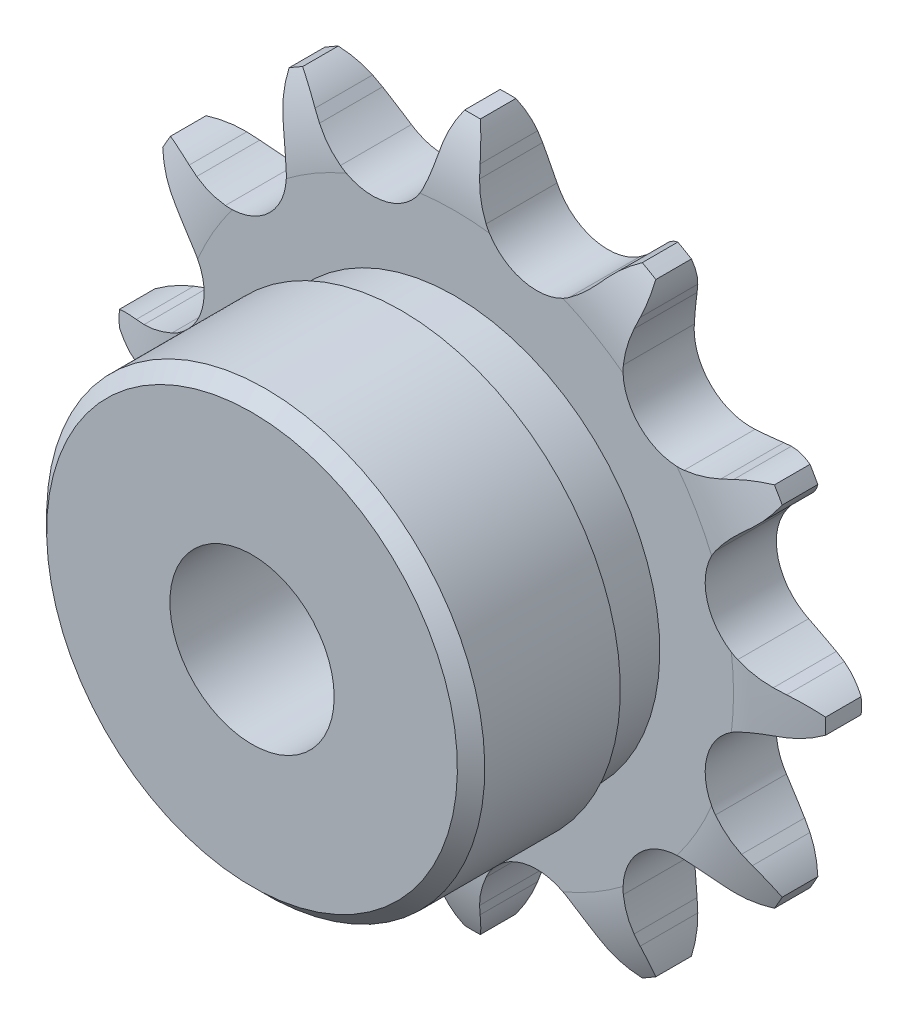
from build123d import *

# Parameters (mm, degrees)
CUT_EXTRUDE1_DEPTH      = 19.425253203
CIRPATTERN1_COUNT       = 12
BOSS_EXTRUDE1_START     = 1.3
SKETCH2_R               = 8
BOSS_EXTRUDE1_DEPTH     = 7.4
CUT_EXTRUDE2_DEPTH      = 21.334452557
CUT_EXTRUDE2_DEPTH_BACK = 21.334452557
SKETCH3_R               = 3
SKETCH4_W               = 1.95
SKETCH4_H               = 5.505042508
CUT_EXTRUDE3_DEPTH      = 21.334452557
CUT_EXTRUDE3_DEPTH_BACK = 21.334452557
SKETCH5_OUTSIDE_W       = 35.61
SKETCH5_OUTSIDE_H       = 35.61
SKETCH5_OUTSIDE_R       = 12.9


with BuildPart() as part:
    # Sketch1 → Revolve1 (revolve)
    with BuildSketch(Plane(origin=(0, 0, 0), x_dir=(0, 0, -1), z_dir=(1, 0, 0))):
        with BuildLine():
            Line((1.3, 0), (-1.3, 0))
            Line((-1.3, 0), (-1.3, 10.183680201))
            ThreePointArc((-1.3, 10.183680201), (-1.122370651, 11.632817875), (-0.6, 12.996152423))
            Line((-0.6, 12.996152423), (0.6, 12.996152423))
            ThreePointArc((0.6, 12.996152423), (1.122370651, 11.632817875), (1.3, 10.183680201))
            Line((1.3, 10.183680201), (1.3, 0))
        make_face()
    revolve(axis=Axis((0, 0, -1.3), (0, 0, 1)))

    # Sketch0 → Cut-Extrude1 (cut, symmetric)
    with BuildSketch(Plane.XY):
        with BuildLine():
            Line((5.347244826, -10.623186043), (5.08501768, -10.328523782))
            ThreePointArc((5.08501768, -10.328523782), (4.653470586, -9.896976688), (4.174741899, -9.518447121))
            ThreePointArc((4.174741899, -9.518447121), (2.469912714, -9.217839738), (1.143791021, -10.330587961))
            ThreePointArc((1.143791021, -10.330587961), (0.918464601, -10.897768526), (0.760507401, -11.487272819))
            Line((0.760507401, -11.487272819), (0.680743162, -11.873571395))
            ThreePointArc((0.680743162, -11.873571395), (-0.793674712, -14.017386392), (-3.35777046, -14.459273028))
            ThreePointArc((-3.35777046, -14.459273028), (3.841917429, -14.338231043), (10.137551033, -10.843212533))
            ThreePointArc((10.137551033, -10.843212533), (7.696035659, -11.742575354), (5.347244826, -10.623186043))
        make_face()
    cut_extrude1 = extrude(amount=CUT_EXTRUDE1_DEPTH, both=True, mode=Mode.SUBTRACT)

    # CirPattern1: Cut-Extrude1 ×12 about axis
    cirpattern1_axis = Axis((0, 0, 0), (0, 0, 1))
    for i in range(1, CIRPATTERN1_COUNT):
        add(cut_extrude1.rotate(cirpattern1_axis, i * 360 / CIRPATTERN1_COUNT), mode=Mode.SUBTRACT)

    # Sketch2 → Boss-Extrude1 (add)
    with BuildSketch(Plane.XY.offset(BOSS_EXTRUDE1_START)):
        with Locations(Location((0, 0, 0), (0, 0, 270))):
            Circle(SKETCH2_R)
    extrude(amount=BOSS_EXTRUDE1_DEPTH)

    # Sketch3 → Cut-Extrude2 (cut, two sides: drawn at the far end of the back side and taken through both)
    with BuildSketch(Plane.XY.offset(-CUT_EXTRUDE2_DEPTH_BACK)):
        Circle(SKETCH3_R)
    extrude(amount=CUT_EXTRUDE2_DEPTH + CUT_EXTRUDE2_DEPTH_BACK, mode=Mode.SUBTRACT)

    # Sketch4 → Cut-Revolve1 (revolve, cut)
    with BuildSketch(Plane(origin=(0, 0, 0), x_dir=(0, 0, -1), z_dir=(1, 0, 0))):
        Polygon((-8.7, 8), (-8.7, 7.5), (-8.2, 8), align=None)
        with Locations((-2.275, 10.243631169)):
            Rectangle(SKETCH4_W, SKETCH4_H)
    revolve(axis=Axis((0, 0, -1.3), (0, 0, 1)), mode=Mode.SUBTRACT)

    # Sketch5 outside → Cut-Extrude3 (cut, two sides: drawn at the far end of the back side and taken through both)
    with BuildSketch(Plane.XY.offset(-CUT_EXTRUDE3_DEPTH_BACK)):
        Rectangle(SKETCH5_OUTSIDE_W, SKETCH5_OUTSIDE_H)
        Circle(SKETCH5_OUTSIDE_R, mode=Mode.SUBTRACT)
    extrude(amount=CUT_EXTRUDE3_DEPTH + CUT_EXTRUDE3_DEPTH_BACK, mode=Mode.SUBTRACT)


solid = part.part
